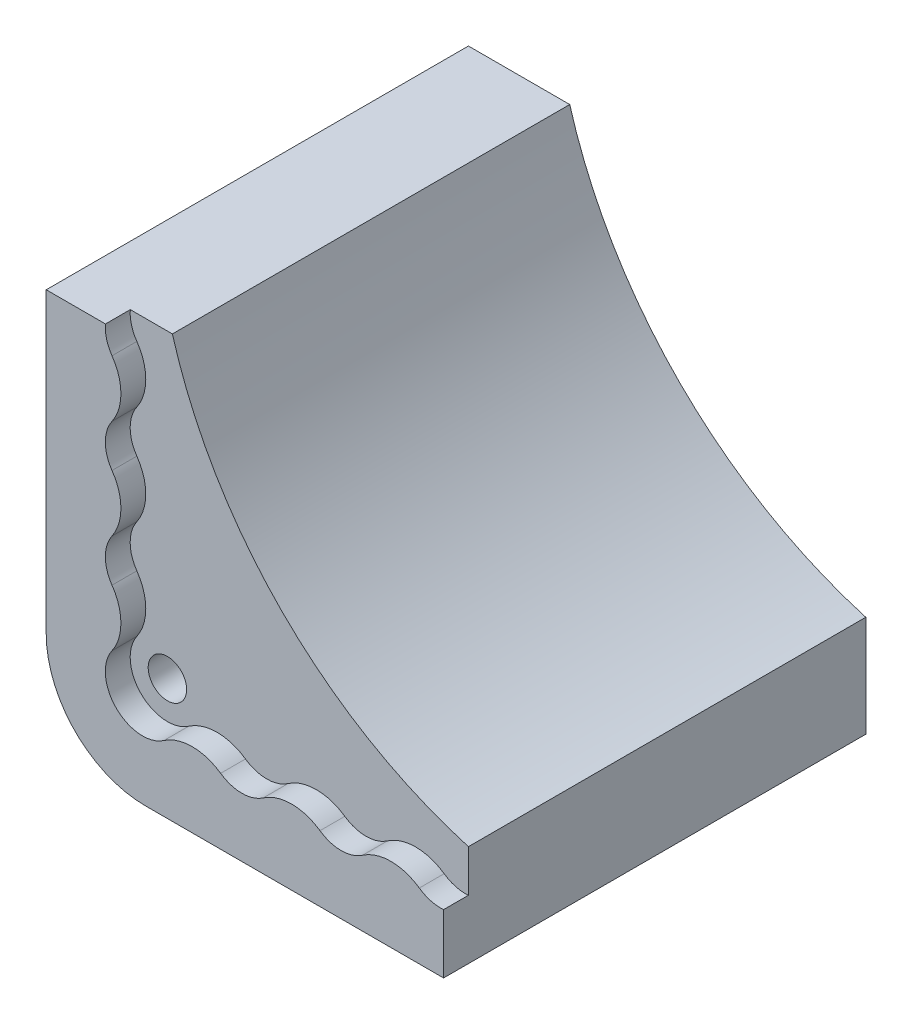
from build123d import *

# Parameters (mm, degrees)
BOSS_EXTRUDE1_DEPTH          = 53.975
F_10_0_1935_DIAMETER_HOLE1_D = 4.9149
CUT_EXTRUDE2_DEPTH           = 90.858670283
CUT_EXTRUDE3_START           = -3.175
SKETCH4_4_R                  = 2.45745
CUT_EXTRUDE3_DEPTH           = 3.175
CUT_EXTRUDE5_DEPTH           = 88.988181024
EXTRUDE_THIN1_DEPTH          = 50.8


with BuildPart() as part:
    # Sketch1 → Boss-Extrude1 (new body)
    with BuildSketch(Plane.XY):
        Polygon((0, 0), (50.8, 0), (50.8, 25.4), (25.4, 25.4), (25.4, 50.8), (0, 50.8), align=None)
    extrude(amount=BOSS_EXTRUDE1_DEPTH)

    # #10 (0.1935) Diameter Hole1 (through all)
    with Locations(Plane(origin=(12.319, 12.319, 53.975), x_dir=(1, 0, 0), z_dir=(0, 0, 1))):
        with Locations((0, 0)):
            Hole(F_10_0_1935_DIAMETER_HOLE1_D / 2)

    # Sketch4 → Cut-Extrude2 (cut, through all)
    with BuildSketch(Plane.XY.offset(53.975)):
        with BuildLine():
            ThreePointArc((12.7, 0), (3.719743879, 3.719743879), (0, 12.7))
            Line((0, 12.7), (0, 0))
            Line((0, 0), (12.7, 0))
        make_face()
    extrude(amount=-CUT_EXTRUDE2_DEPTH, mode=Mode.SUBTRACT)

    # Sketch4<4> → Cut-Extrude3 (cut)
    with BuildSketch(Plane.XY.offset(53.975).offset(CUT_EXTRUDE3_START)):
        with BuildLine():
            Line((25.4, 50.8), (7.571764462, 50.8))
            ThreePointArc((7.571764462, 50.8), (7.721601354, 49.175886193), (8.410645771, 47.697571429))
            ThreePointArc((8.410645771, 47.697571429), (9.549506799, 44.069), (8.410645771, 40.440428571))
            ThreePointArc((8.410645771, 40.440428571), (7.5565, 37.719), (8.410645771, 34.997571429))
            ThreePointArc((8.410645771, 34.997571429), (9.549506799, 31.369), (8.410645771, 27.740428571))
            ThreePointArc((8.410645771, 27.740428571), (7.5565, 25.019), (8.410645771, 22.297571429))
            ThreePointArc((8.410645771, 22.297571429), (9.549506799, 18.669), (8.410645771, 15.040428571))
            ThreePointArc((8.410645771, 15.040428571), (8.951403955, 8.951403955), (15.040428571, 8.410645771))
            ThreePointArc((15.040428571, 8.410645771), (16.767452272, 9.258105336), (18.669, 9.549506799))
            ThreePointArc((18.669, 9.549506799), (20.570547728, 9.258105336), (22.297571429, 8.410645771))
            ThreePointArc((22.297571429, 8.410645771), (25.019, 7.5565), (27.740428571, 8.410645771))
            ThreePointArc((27.740428571, 8.410645771), (29.467452272, 9.258105336), (31.369, 9.549506799))
            ThreePointArc((31.369, 9.549506799), (33.270547728, 9.258105336), (34.997571429, 8.410645771))
            ThreePointArc((34.997571429, 8.410645771), (37.719, 7.5565), (40.440428571, 8.410645771))
            ThreePointArc((40.440428571, 8.410645771), (42.167452272, 9.258105336), (44.069, 9.549506799))
            ThreePointArc((44.069, 9.549506799), (45.970547728, 9.258105336), (47.697571429, 8.410645771))
            ThreePointArc((47.697571429, 8.410645771), (49.175886193, 7.721601354), (50.8, 7.571764462))
            Line((50.8, 7.571764462), (50.8, 25.4))
            Line((50.8, 25.4), (25.4, 25.4))
            Line((25.4, 25.4), (25.4, 50.8))
        make_face()
        with Locations((12.319, 12.319)):
            Circle(SKETCH4_4_R, mode=Mode.SUBTRACT)
    extrude(amount=CUT_EXTRUDE3_DEPTH, mode=Mode.SUBTRACT)

    # Sketch7 → Cut-Extrude5 (cut, through all)
    with BuildSketch(Plane.XY.offset(50.8)):
        with BuildLine():
            Line((25.4, 50.8), (12.954, 50.8))
            ThreePointArc((12.954, 50.8), (17.900023052, 39.035105247), (25.4, 28.709107069))
            Line((25.4, 28.709107069), (25.4, 50.8))
        make_face()
        with BuildLine():
            Line((50.8, 25.4), (28.709107069, 25.4))
            ThreePointArc((28.709107069, 25.4), (39.035105247, 17.900023052), (50.8, 12.954))
            Line((50.8, 12.954), (50.8, 25.4))
        make_face()
    extrude(amount=-CUT_EXTRUDE5_DEPTH, mode=Mode.SUBTRACT)

    # Sketch8 → Extrude-Thin1 (add)
    with BuildSketch(Plane.XY.offset(50.8)):
        with BuildLine():
            ThreePointArc((25.4, 28.709107069), (27.019699139, 27.019699139), (28.709107069, 25.4))
            Line((28.709107069, 25.4), (26.990285921, 23.529905387))
            ThreePointArc((26.990285921, 23.529905387), (25.223647915, 25.223647915), (23.529905387, 26.990285921))
            Line((23.529905387, 26.990285921), (25.4, 28.709107069))
        make_face()
    extrude(amount=-EXTRUDE_THIN1_DEPTH)


solid = part.part
